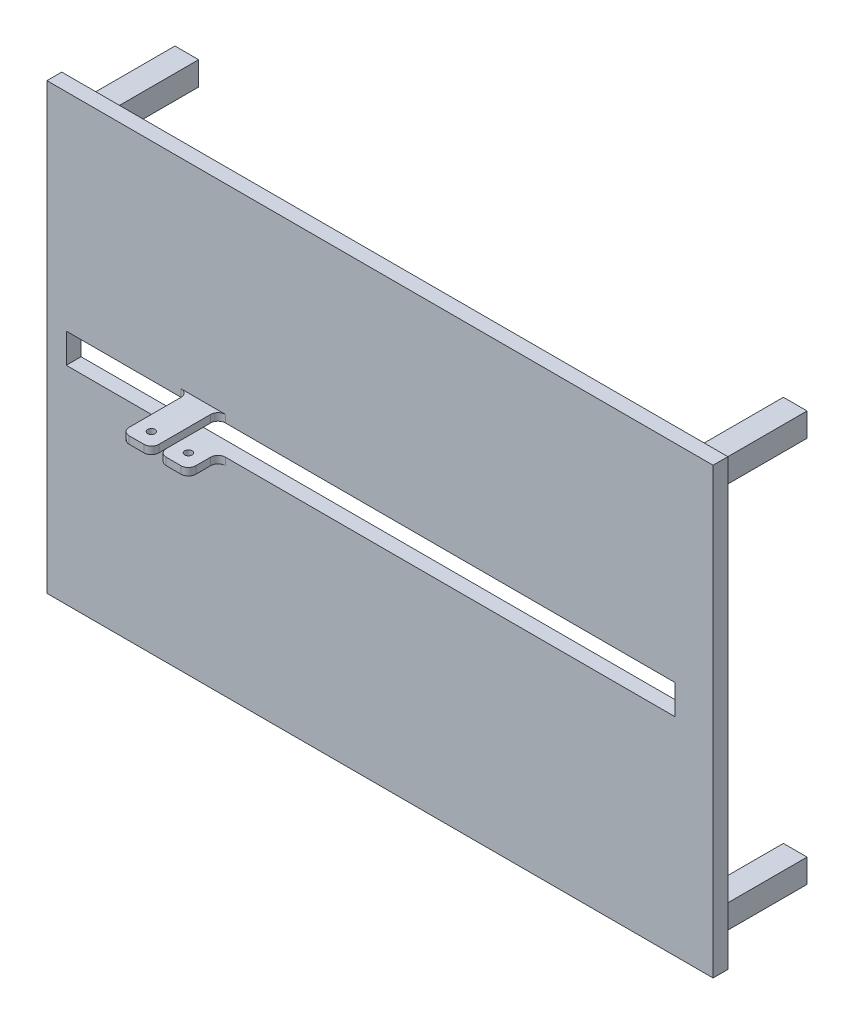
from build123d import *

# Parameters (mm, degrees)
SKETCH1_W           = 1300
SKETCH1_H           = 600
SKETCH1_W_2         = 1117.676372874
SKETCH1_H_2         = 40
BOSS_EXTRUDE1_DEPTH = 20
SKETCH2_W           = 40
SKETCH2_H           = 10
BOSS_EXTRUDE2_DEPTH = 40
SKETCH3_R           = 5
CUT_EXTRUDE1_DEPTH  = 10
SKETCH4_W           = 40
SKETCH4_H           = 10
BOSS_EXTRUDE3_DEPTH = 50
SKETCH5_R           = 5
CUT_EXTRUDE2_DEPTH  = 10
FILLET1_R           = 10
FILLET2_R           = 10
FILLET3_R           = 10
FILLET4_R           = 10
FILLET5_R           = 10
FILLET6_R           = 10
FILLET7_R           = 10
FILLET8_R           = 10
SKETCH6_W           = 20
SKETCH6_H           = 40
BOSS_EXTRUDE4_DEPTH = 260
SKETCH7_W           = 20
SKETCH7_H           = 40
BOSS_EXTRUDE5_DEPTH = 35
SKETCH8_W           = 20
SKETCH8_H           = 600
CUT_EXTRUDE3_DEPTH  = 100
SKETCH9_W           = 20
SKETCH9_H           = 600
CUT_EXTRUDE4_DEPTH  = 300
SKETCH10_W          = 32
SKETCH10_H          = 32
SKETCH10_W_2        = 26
SKETCH10_H_2        = 26
BOSS_EXTRUDE6_DEPTH = 130


with BuildPart() as part:
    # Sketch1 → Boss-Extrude1 (new body)
    with BuildSketch(Plane.XY):
        Rectangle(SKETCH1_W, SKETCH1_H)
        Rectangle(SKETCH1_W_2, SKETCH1_H_2, mode=Mode.SUBTRACT)
    extrude(amount=BOSS_EXTRUDE1_DEPTH)

    # Sketch2 → Boss-Extrude2 (add)
    with BuildSketch(Plane.XY.offset(20)):
        with Locations((-338.838186437, 25)):
            Rectangle(SKETCH2_W, SKETCH2_H)
        with Locations((-338.838186437, -25)):
            Rectangle(SKETCH2_W, SKETCH2_H)
    extrude(amount=BOSS_EXTRUDE2_DEPTH)

    # Sketch3 → Cut-Extrude1 (cut)
    with BuildSketch(Plane.XZ.offset(30)):
        with Locations((-338.838186437, 40)):
            Circle(SKETCH3_R)
    extrude(amount=-CUT_EXTRUDE1_DEPTH, mode=Mode.SUBTRACT)

    # Sketch4 → Boss-Extrude3 (add)
    with BuildSketch(Plane.XY.offset(60)):
        with Locations((-338.838186437, 25)):
            Rectangle(SKETCH4_W, SKETCH4_H)
    extrude(amount=BOSS_EXTRUDE3_DEPTH)

    # Sketch5 → Cut-Extrude2 (cut)
    with BuildSketch(Plane.XZ.offset(-20)):
        with Locations(Location((-338.838186437, 90, 0), (0, 0, 270))):
            Circle(SKETCH5_R)
    extrude(amount=-CUT_EXTRUDE2_DEPTH, mode=Mode.SUBTRACT)

    # Fillet1
    fillet1_edges = [part.edges().sort_by_distance(p)[0] for p in [
        (-318.838186437, -25, 20),
    ]]
    fillet(fillet1_edges, radius=FILLET1_R)

    # Fillet2
    fillet2_edges = [part.edges().sort_by_distance(p)[0] for p in [
        (-318.838186437, 25, 20),
    ]]
    fillet(fillet2_edges, radius=FILLET2_R)

    # Fillet3
    fillet3_edges = [part.edges().sort_by_distance(p)[0] for p in [
        (-358.838186437, -25, 20),
    ]]
    fillet(fillet3_edges, radius=FILLET3_R)

    # Fillet4
    fillet4_edges = [part.edges().sort_by_distance(p)[0] for p in [
        (-358.838186437, 25, 20),
    ]]
    fillet(fillet4_edges, radius=FILLET4_R)

    # Fillet5
    fillet5_edges = [part.edges().sort_by_distance(p)[0] for p in [
        (-318.838186437, -25, 60),
    ]]
    fillet(fillet5_edges, radius=FILLET5_R)

    # Fillet6
    fillet6_edges = [part.edges().sort_by_distance(p)[0] for p in [
        (-358.838186437, -25, 60),
    ]]
    fillet(fillet6_edges, radius=FILLET6_R)

    # Fillet7
    fillet7_edges = [part.edges().sort_by_distance(p)[0] for p in [
        (-358.838186437, 25, 110),
    ]]
    fillet(fillet7_edges, radius=FILLET7_R)

    # Fillet8
    fillet8_edges = [part.edges().sort_by_distance(p)[0] for p in [
        (-318.838186437, 25, 110),
    ]]
    fillet(fillet8_edges, radius=FILLET8_R)

    # Sketch6 → Boss-Extrude4 (add)
    with BuildSketch(Plane.ZY.offset(-558.838186437)):
        with Locations((10, 0)):
            Rectangle(SKETCH6_W, SKETCH6_H)
    extrude(amount=BOSS_EXTRUDE4_DEPTH)

    # Sketch7 → Boss-Extrude5 (add)
    with BuildSketch(Plane(origin=(-558.838186437, 0, 0), x_dir=(0, 0, -1), z_dir=(1, 0, 0))):
        with Locations((-10, 0)):
            Rectangle(SKETCH7_W, SKETCH7_H)
    extrude(amount=BOSS_EXTRUDE5_DEPTH)

    # Sketch8 → Cut-Extrude3 (cut)
    with BuildSketch(Plane.ZY.offset(650)):
        with Locations((10, 0)):
            Rectangle(SKETCH8_W, SKETCH8_H)
    extrude(amount=-CUT_EXTRUDE3_DEPTH, mode=Mode.SUBTRACT)

    # Sketch9 → Cut-Extrude4 (cut)
    with BuildSketch(Plane(origin=(650, 0, 0), x_dir=(0, 0, -1), z_dir=(1, 0, 0))):
        with Locations((-10, 0)):
            Rectangle(SKETCH9_W, SKETCH9_H)
    extrude(amount=-CUT_EXTRUDE4_DEPTH, mode=Mode.SUBTRACT)

    # Sketch10 → Boss-Extrude6 (add)
    # profile 1 of 4: a face of its own
    with BuildSketch(Plane(origin=(0, 0, 0), x_dir=(-1, 0, 0), z_dir=(0, 0, -1))):
        with Locations((511, -261)):
            Rectangle(SKETCH10_W, SKETCH10_H)
        with Locations((511, -261)):
            Rectangle(SKETCH10_W_2, SKETCH10_H_2, mode=Mode.SUBTRACT)
    # profile 2 of 4: a face of its own
    with BuildSketch(Plane(origin=(0, 0, 0), x_dir=(-1, 0, 0), z_dir=(0, 0, -1))):
        with Locations((-311, -261)):
            Rectangle(SKETCH10_W, SKETCH10_H)
        with Locations((-311, -261)):
            Rectangle(SKETCH10_W_2, SKETCH10_H_2, mode=Mode.SUBTRACT)
    # profile 3 of 4: a face of its own
    with BuildSketch(Plane(origin=(0, 0, 0), x_dir=(-1, 0, 0), z_dir=(0, 0, -1))):
        with Locations((-311, 261)):
            Rectangle(SKETCH10_W, SKETCH10_H)
        with Locations((-311, 261)):
            Rectangle(SKETCH10_W_2, SKETCH10_H_2, mode=Mode.SUBTRACT)
    # profile 4 of 4: a face of its own
    with BuildSketch(Plane(origin=(0, 0, 0), x_dir=(-1, 0, 0), z_dir=(0, 0, -1))):
        with Locations((511, 261)):
            Rectangle(SKETCH10_W, SKETCH10_H)
        with Locations((511, 261)):
            Rectangle(SKETCH10_W_2, SKETCH10_H_2, mode=Mode.SUBTRACT)
    extrude(amount=BOSS_EXTRUDE6_DEPTH)


solid = part.part
